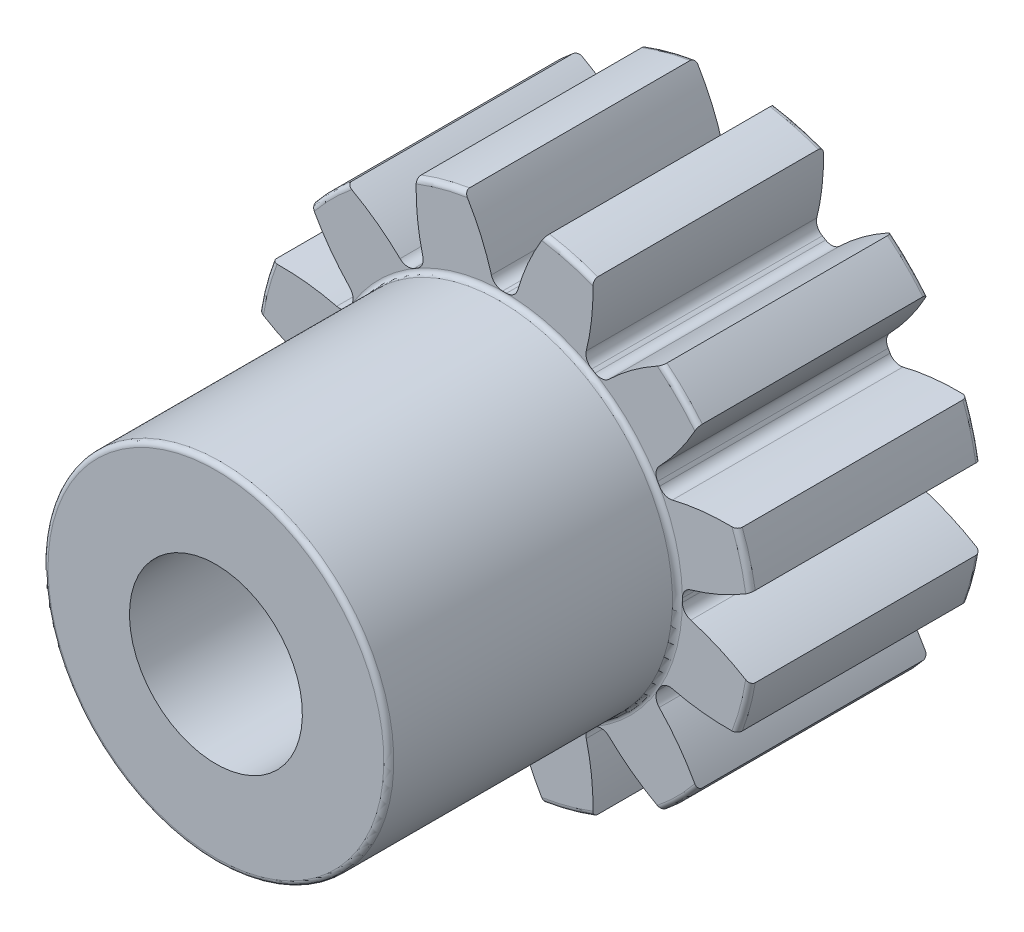
from build123d import *

# Parameters (mm, degrees)
FILLET2_R          = 0.13716
CUT_EXTRUDE2_DEPTH = 13.540734061
CIRPATTERN1_COUNT  = 12


with BuildPart() as part:
    # Sketch4 → Revolve1 (revolve)
    with BuildSketch(Plane(origin=(0, 0, 0), x_dir=(0, 0, -1), z_dir=(1, 0, 0))):
        Polygon((-14.3002, 2.38125), (-14.3002, 4.7625), (-6.35, 4.7625), (-6.35, 6.858), (0, 6.858), (0, 2.38125), align=None)
    revolve(axis=Axis((0, 0, 6.35), (0, 0, 1)))

    # Fillet2
    fillet2_edges = [part.edges().sort_by_distance(p)[0] for p in [
        (0, -6.858, 0),
        (0, -6.858, 6.35),
        (0, -4.7625, 6.35),
        (0, -4.7625, 14.3002),
    ]]
    fillet(fillet2_edges, radius=FILLET2_R)

    # Sketch7 → Cut-Extrude2 (cut, through all)
    with BuildSketch(Plane.XY.offset(6.35)):
        with BuildLine():
            ThreePointArc((-0.053257036, 4.89979391), (0, 4.900083333), (0.053257036, 4.89979391))
            ThreePointArc((0.053257036, 4.89979391), (0.246101104, 4.962443004), (0.361712631, 5.129019468))
            ThreePointArc((0.361712631, 5.129019468), (0.67332942, 5.975315564), (1.10169326, 6.768931671))
            ThreePointArc((1.10169326, 6.768931671), (0, 6.858), (-1.10169326, 6.768931671))
            ThreePointArc((-1.10169326, 6.768931671), (-0.67332942, 5.975315564), (-0.361712631, 5.129019468))
            ThreePointArc((-0.361712631, 5.129019468), (-0.246101104, 4.962443004), (-0.053257036, 4.89979391))
        make_face()
    cut_extrude2 = extrude(amount=-CUT_EXTRUDE2_DEPTH, mode=Mode.SUBTRACT)

    # CirPattern1: Cut-Extrude2 ×12 about axis
    cirpattern1_axis = Axis((0, 0, 0), (0, 0, 1))
    for i in range(1, CIRPATTERN1_COUNT):
        add(cut_extrude2.rotate(cirpattern1_axis, i * 360 / CIRPATTERN1_COUNT), mode=Mode.SUBTRACT)


solid = part.part
